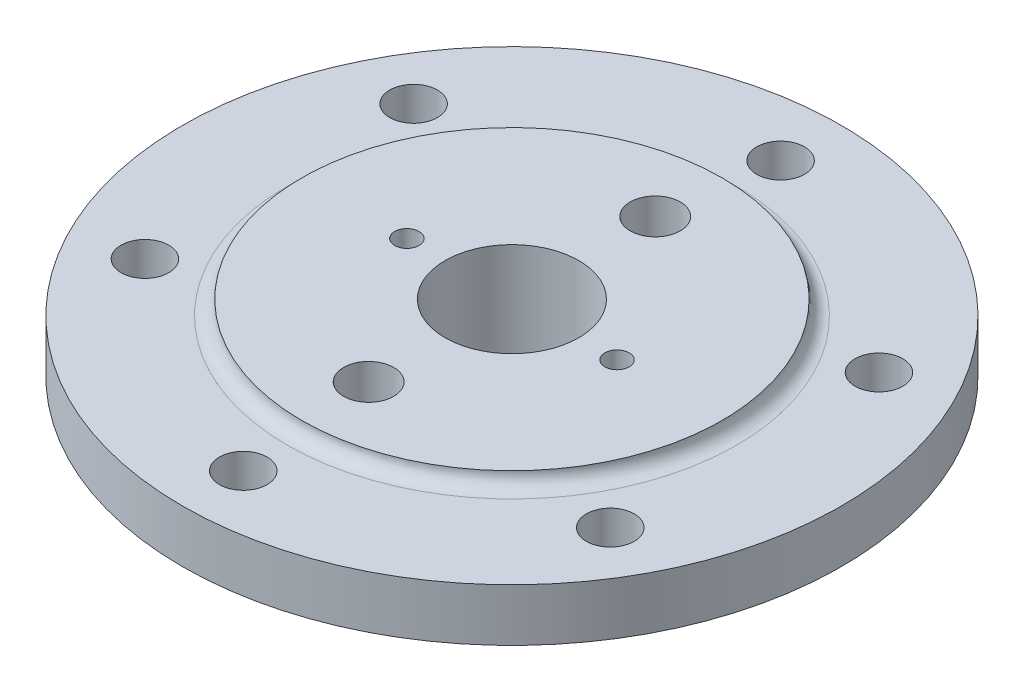
from build123d import *

# Parameters (mm, degrees)
CUT_EXTRUDE1_REACH     = 211.077
SKETCH2_R              = 10
M24_TAPPED_HOLE1_D     = 21
M24_TAPPED_HOLE1_DEPTH = 27
M24_TAPPED_HOLE1_TIP   = 6.3090365
M12_TAPPED_HOLE1_D     = 10.2
M12_TAPPED_HOLE1_DEPTH = 50
M12_TAPPED_HOLE1_TIP   = 3.064389157


with BuildPart() as part:
    # Sketch1 → Revolve1 (revolve)
    with BuildSketch(Plane(origin=(0, 0, 0), x_dir=(0, 0, -1), z_dir=(1, 0, 0)), mode=Mode.PRIVATE) as revolve1_sk:
        with BuildLine():
            Line((14, 0), (35, 0))
            Line((35, 0), (81, 47))
            Line((81, 47), (81, 53))
            Line((81, 53), (138, 53))
            Line((138, 53), (138, 75))
            Line((138, 75), (94, 75))
            ThreePointArc((94, 75), (89.757359313, 76.757359313), (88, 81))
            Line((88, 81), (28, 81))
            Line((28, 81), (28, 39.304347826))
            Line((28, 39.304347826), (14, 25))
            Line((14, 25), (14, 0))
        make_face()
    revolve(revolve1_sk.sketch.rotate(Axis((0, 28, 0), (0, -1, 0)), 180), axis=Axis((0, 28, 0), (0, -1, 0)))

    # Sketch2 → Cut-Extrude1 (cut, up to next)
    with BuildSketch(Plane(origin=(0, 75, 0), x_dir=(1, 0, 0), z_dir=(0, 1, 0)), mode=Mode.PRIVATE) as cut_extrude1_sk1:
        with Locations(Location((0, 112.5, 0), (0, 0, 270))):
            Circle(SKETCH2_R)
    cut_extrude1_tool1 = extrude(cut_extrude1_sk1.sketch, amount=-CUT_EXTRUDE1_REACH, mode=Mode.PRIVATE) & part.part
    # Sketch2 → Cut-Extrude1 (cut, up to next)
    with BuildSketch(Plane(origin=(0, 75, 0), x_dir=(1, 0, 0), z_dir=(0, 1, 0)), mode=Mode.PRIVATE) as cut_extrude1_sk2:
        with Locations(Location((97.427857926, 56.25, 0), (0, 0, 270))):
            Circle(SKETCH2_R)
    cut_extrude1_tool2 = extrude(cut_extrude1_sk2.sketch, amount=-CUT_EXTRUDE1_REACH, mode=Mode.PRIVATE) & part.part
    # Sketch2 → Cut-Extrude1 (cut, up to next)
    with BuildSketch(Plane(origin=(0, 75, 0), x_dir=(1, 0, 0), z_dir=(0, 1, 0)), mode=Mode.PRIVATE) as cut_extrude1_sk3:
        with Locations(Location((97.427857926, -56.25, 0), (0, 0, 270))):
            Circle(SKETCH2_R)
    cut_extrude1_tool3 = extrude(cut_extrude1_sk3.sketch, amount=-CUT_EXTRUDE1_REACH, mode=Mode.PRIVATE) & part.part
    # Sketch2 → Cut-Extrude1 (cut, up to next)
    with BuildSketch(Plane(origin=(0, 75, 0), x_dir=(1, 0, 0), z_dir=(0, 1, 0)), mode=Mode.PRIVATE) as cut_extrude1_sk4:
        with Locations(Location((0, -112.5, 0), (0, 0, 270))):
            Circle(SKETCH2_R)
    cut_extrude1_tool4 = extrude(cut_extrude1_sk4.sketch, amount=-CUT_EXTRUDE1_REACH, mode=Mode.PRIVATE) & part.part
    # Sketch2 → Cut-Extrude1 (cut, up to next)
    with BuildSketch(Plane(origin=(0, 75, 0), x_dir=(1, 0, 0), z_dir=(0, 1, 0)), mode=Mode.PRIVATE) as cut_extrude1_sk5:
        with Locations(Location((-97.427857926, -56.25, 0), (0, 0, 270))):
            Circle(SKETCH2_R)
    cut_extrude1_tool5 = extrude(cut_extrude1_sk5.sketch, amount=-CUT_EXTRUDE1_REACH, mode=Mode.PRIVATE) & part.part
    # Sketch2 → Cut-Extrude1 (cut, up to next)
    with BuildSketch(Plane(origin=(0, 75, 0), x_dir=(1, 0, 0), z_dir=(0, 1, 0)), mode=Mode.PRIVATE) as cut_extrude1_sk6:
        with Locations(Location((-97.427857926, 56.25, 0), (0, 0, 270))):
            Circle(SKETCH2_R)
    cut_extrude1_tool6 = extrude(cut_extrude1_sk6.sketch, amount=-CUT_EXTRUDE1_REACH, mode=Mode.PRIVATE) & part.part
    add(cut_extrude1_tool1.solids().sort_by_distance((0, 75, -112.5))[0], mode=Mode.SUBTRACT)
    add(cut_extrude1_tool2.solids().sort_by_distance((97.427858, 75, -56.25))[0], mode=Mode.SUBTRACT)
    add(cut_extrude1_tool3.solids().sort_by_distance((97.427858, 75, 56.25))[0], mode=Mode.SUBTRACT)
    add(cut_extrude1_tool4.solids().sort_by_distance((0, 75, 112.5))[0], mode=Mode.SUBTRACT)
    add(cut_extrude1_tool5.solids().sort_by_distance((-97.427858, 75, 56.25))[0], mode=Mode.SUBTRACT)
    add(cut_extrude1_tool6.solids().sort_by_distance((-97.427858, 75, -56.25))[0], mode=Mode.SUBTRACT)

    # M24 Tapped Hole1
    with Locations(Plane(origin=(0, 81, -60), x_dir=(0, 0, 1), z_dir=(0, 1, 0))):
        with Locations((0, 0), (120, 0)):
            Hole(M24_TAPPED_HOLE1_D / 2, depth=M24_TAPPED_HOLE1_DEPTH)
            with Locations((0, 0, -(M24_TAPPED_HOLE1_DEPTH + M24_TAPPED_HOLE1_TIP / 2))):  # 118° drill point
                Cone(0, M24_TAPPED_HOLE1_D / 2, M24_TAPPED_HOLE1_TIP, mode=Mode.SUBTRACT)

    # M12 Tapped Hole1
    with Locations(Plane(origin=(44, 81, 0), x_dir=(0, 0, 1), z_dir=(0, 1, 0))):
        with Locations((0, 0), (0, -88)):
            Hole(M12_TAPPED_HOLE1_D / 2, depth=M12_TAPPED_HOLE1_DEPTH)
            with Locations((0, 0, -(M12_TAPPED_HOLE1_DEPTH + M12_TAPPED_HOLE1_TIP / 2))):  # 118° drill point
                Cone(0, M12_TAPPED_HOLE1_D / 2, M12_TAPPED_HOLE1_TIP, mode=Mode.SUBTRACT)


solid = part.part
